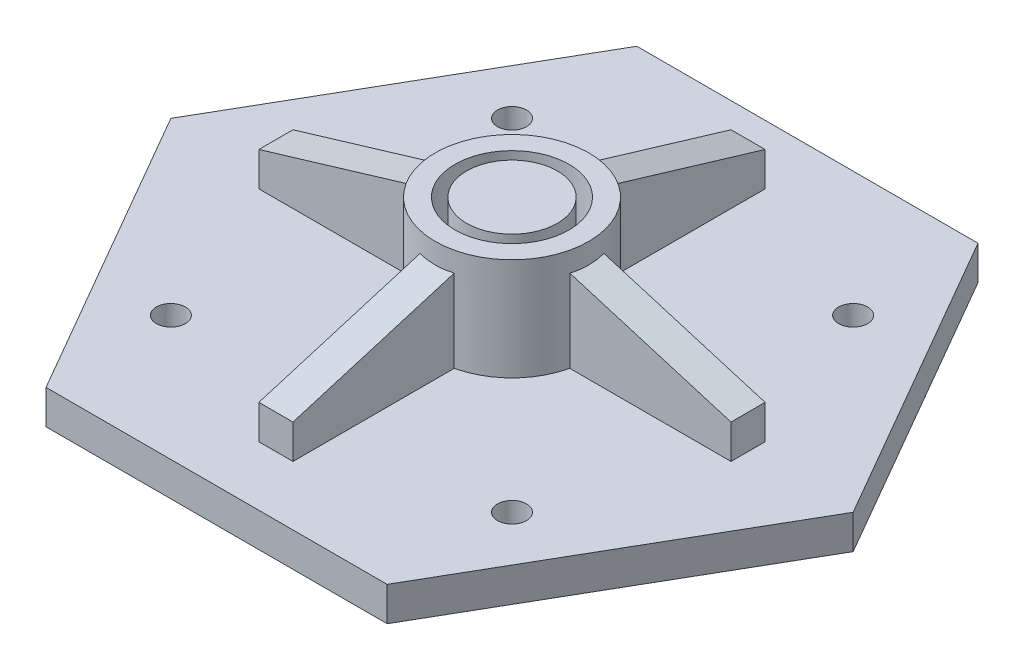
from build123d import *

# Parameters (mm, degrees)
CROQUIS1_R              = 22.5
SALIENTE_EXTRUIR1_DEPTH = 40
CROQUIS2_R              = 16.7
CROQUIS2_R_2            = 13.3
CORTAR_EXTRUIR1_DEPTH   = 30
SALIENTE_EXTRUIR2_DEPTH = 10
SALIENTE_EXTRUIR5_DEPTH = 5
MATRIZC1_COUNT          = 4
CROQUIS5_R              = 4.25
CORTAR_EXTRUIR2_DEPTH   = 136.646599663


with BuildPart() as part:
    # Croquis1 → Saliente-Extruir1 (new body)
    with BuildSketch(Plane(origin=(0, 0, 0), x_dir=(1, 0, 0), z_dir=(0, 1, 0))):
        with Locations(Location((0, 0, 0), (0, 0, 270))):
            Circle(CROQUIS1_R)
    extrude(amount=SALIENTE_EXTRUIR1_DEPTH)

    # Croquis2 → Cortar-Extruir1 (cut)
    with BuildSketch(Plane(origin=(0, 40, 0), x_dir=(1, 0, 0), z_dir=(0, 1, 0))):
        with Locations(Location((0, 0, 0), (0, 0, 270))):
            Circle(CROQUIS2_R)
        with Locations(Location((0, 0, 0), (0, 0, 270))):
            Circle(CROQUIS2_R_2, mode=Mode.SUBTRACT)
    extrude(amount=-CORTAR_EXTRUIR1_DEPTH, mode=Mode.SUBTRACT)

    # Croquis3 → Saliente-Extruir2 (add)
    with BuildSketch(Plane.XZ):
        Polygon((50, 86.602540378), (-50, 86.602540378), (-100, 0), (-50, -86.602540378), (50, -86.602540378), (100, 0), align=None)
    extrude(amount=-SALIENTE_EXTRUIR2_DEPTH)

    # Croquis4 → Saliente-Extruir5 (add, symmetric)
    with BuildSketch(Plane(origin=(0, 0, 0), x_dir=(0, 0, -1), z_dir=(1, 0, 0))):
        Polygon((-69.2, 10), (-19.2, 10), (-19.2, 35), (-69.2, 20), align=None)
    saliente_extruir5 = extrude(amount=SALIENTE_EXTRUIR5_DEPTH, both=True)

    # MatrizC1: Saliente-Extruir5 ×4 about axis
    matrizc1_axis = Axis((0, 0, 0), (0, 1, 0))
    for i in range(1, MATRIZC1_COUNT):
        add(saliente_extruir5.rotate(matrizc1_axis, i * 360 / MATRIZC1_COUNT))

    # Croquis5 → Cortar-Extruir2 (cut, through all)
    with BuildSketch(Plane(origin=(0, 10, 0), x_dir=(1, 0, 0), z_dir=(0, 1, 0))):
        with Locations(Location((-50, 50, 0), (0, 0, 270))):
            Circle(CROQUIS5_R)
        with Locations(Location((50, 50, 0), (0, 0, 270))):
            Circle(CROQUIS5_R)
        with Locations(Location((-50, -50, 0), (0, 0, 270))):
            Circle(CROQUIS5_R)
        with Locations(Location((50, -50, 0), (0, 0, 270))):
            Circle(CROQUIS5_R)
    extrude(amount=-CORTAR_EXTRUIR2_DEPTH, mode=Mode.SUBTRACT)


solid = part.part
